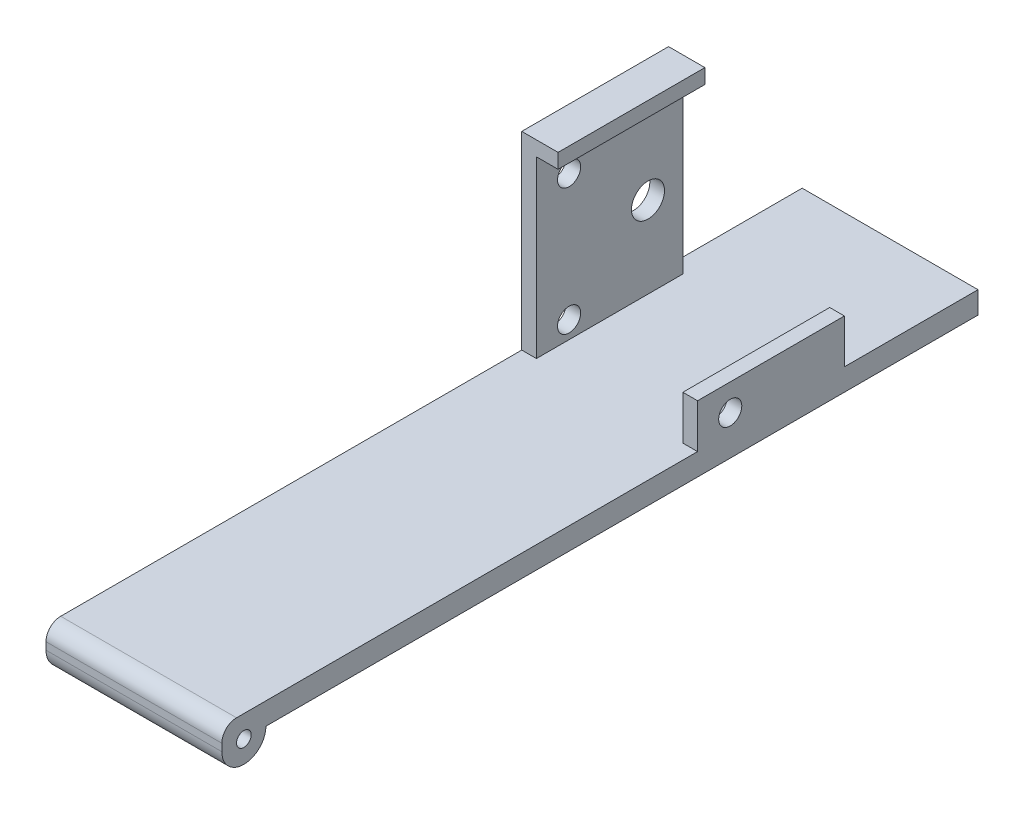
from build123d import *

# Parameters (mm, degrees)
SKETCH1_R           = 1
BOSS_EXTRUDE1_DEPTH = 11.975
SKETCH2_W           = 20
SKETCH2_H           = 23.8
SKETCH2_R           = 1.575
SKETCH2_R_2         = 2.25
BOSS_EXTRUDE2_DEPTH = 2
SKETCH3_W           = 23.95
SKETCH3_H           = 20
BOSS_EXTRUDE3_DEPTH = 2
SKETCH4_W           = 20
SKETCH4_H           = 19.8
CUT_EXTRUDE1_DEPTH  = 19


with BuildPart() as part:
    # Sketch1 → Boss-Extrude1 (new, symmetric)
    with BuildSketch(Plane(origin=(0, 0, 0), x_dir=(0, 0, -1), z_dir=(1, 0, 0))):
        with BuildLine():
            Line((21.768222654, 1.933048137), (-79.231777346, 1.933048137))
            ThreePointArc((-79.231777346, 1.933048137), (-80.645990908, 1.347261699), (-81.231777346, -0.066951863))
            Line((-81.231777346, -0.066951863), (-81.231777346, -1.066951863))
            ThreePointArc((-81.231777346, -1.066951863), (-78.231777346, -4.066951863), (-75.231777346, -1.066951863))
            Line((-75.231777346, -1.066951863), (21.768222654, -1.066951863))
            Line((21.768222654, -1.066951863), (21.768222654, 1.933048137))
        make_face()
        with Locations((-78.231777346, -1.066951863)):
            Circle(SKETCH1_R, mode=Mode.SUBTRACT)
    extrude(amount=BOSS_EXTRUDE1_DEPTH, both=True)

    # Sketch2 → Boss-Extrude2 (add)
    with BuildSketch(Plane(origin=(11.975, 0, 0), x_dir=(0, 0, -1), z_dir=(1, 0, 0))):
        with Locations((-6.431536694, 13.833048137)):
            Rectangle(SKETCH2_W, SKETCH2_H)
        with Locations((-11.981536694, 4.308048137)):
            Circle(SKETCH2_R, mode=Mode.SUBTRACT)
        with Locations((-11.981536694, 21.558048137)):
            Circle(SKETCH2_R, mode=Mode.SUBTRACT)
        with Locations((-1.231536694, 13.033048137)):
            Circle(SKETCH2_R_2, mode=Mode.SUBTRACT)
    boss_extrude2 = extrude(amount=-BOSS_EXTRUDE2_DEPTH)

    # Mirror1: Boss-Extrude2 across plane
    add(boss_extrude2.mirror(Plane(origin=(0, 0, 0), x_dir=(0, 0, 1), z_dir=(1, 0, 0))))

    # Sketch3 → Boss-Extrude3 (add)
    with BuildSketch(Plane(origin=(0, 25.733048137, 0), x_dir=(1, 0, 0), z_dir=(0, 1, 0))):
        with Locations((0, -6.431536694)):
            Rectangle(SKETCH3_W, SKETCH3_H)
    extrude(amount=BOSS_EXTRUDE3_DEPTH)

    # Sketch4 → Cut-Extrude1 (cut)
    with BuildSketch(Plane(origin=(11.975, 0, 0), x_dir=(0, 0, -1), z_dir=(1, 0, 0))):
        with Locations((-6.431536694, 17.833048137)):
            Rectangle(SKETCH4_W, SKETCH4_H)
    extrude(amount=-CUT_EXTRUDE1_DEPTH, mode=Mode.SUBTRACT)


solid = part.part
